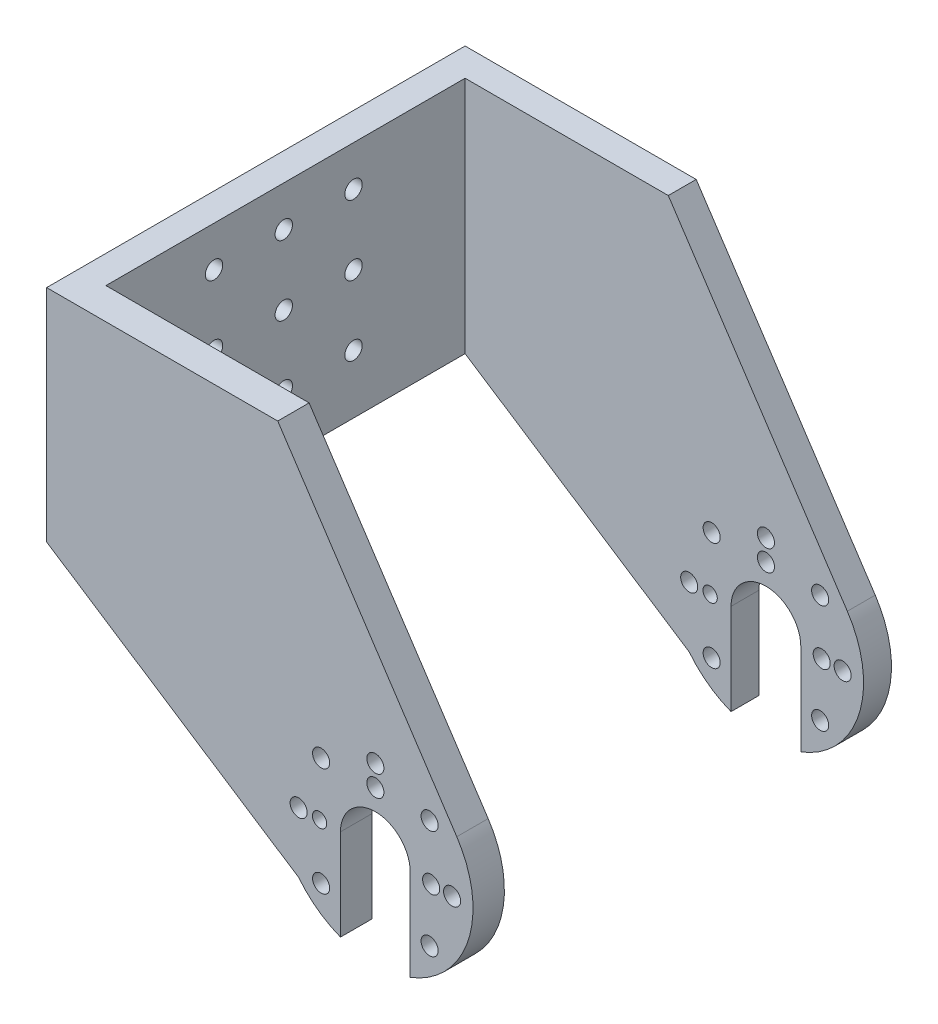
from build123d import *

# Parameters (mm, degrees)
SKETCH_1_R          = 5
SKETCH_1_R_2        = 1.225
SKETCH_1_R_3        = 1.025
EXTRUDE_1_DEPTH     = 60
SKETCH_2_W          = 57.132931415
SKETCH_2_H          = 51.5
CUT_EXTRUDE_1_DEPTH = 66
CUT_EXTRUDE_START   = -60.33903683
CUT_EXTRUDE_3_DEPTH = 60.33903683
SKETCH_6_R          = 1.25
CUT_EXTRUDE_4_DEPTH = 10


with BuildPart() as part:
    # 스케치1 → 보스-돌출1 (new body)
    with BuildSketch(Plane.XY):
        with BuildLine():
            Line((11.674013781, 7.727703555), (-14, 46.512678751))
            Line((-14, 46.512678751), (-47.132931415, 46.512678751))
            Line((-47.132931415, 46.512678751), (-47.132931415, 14.921692086))
            Line((-47.132931415, 14.921692086), (-11, -8.660254038))
            ThreePointArc((-11, -8.660254038), (8.200906179, -11.346591463), (11.674013781, 7.727703555))
        make_face()
        Circle(SKETCH_1_R, mode=Mode.SUBTRACT)
        with Locations((0, 8)):
            Circle(SKETCH_1_R_2, mode=Mode.SUBTRACT)
        with Locations((0, 11)):
            Circle(SKETCH_1_R_2, mode=Mode.SUBTRACT)
        with Locations((7.778174593, 7.778174593)):
            Circle(SKETCH_1_R_2, mode=Mode.SUBTRACT)
        with Locations((8, 0)):
            Circle(SKETCH_1_R_2, mode=Mode.SUBTRACT)
        with Locations((11, 0)):
            Circle(SKETCH_1_R_2, mode=Mode.SUBTRACT)
        with Locations((7.778174593, -7.778174593)):
            Circle(SKETCH_1_R_2, mode=Mode.SUBTRACT)
        with Locations((0, -8)):
            Circle(SKETCH_1_R_2, mode=Mode.SUBTRACT)
        with Locations((0, -11)):
            Circle(SKETCH_1_R_2, mode=Mode.SUBTRACT)
        with Locations((-7.778174593, -7.778174593)):
            Circle(SKETCH_1_R_2, mode=Mode.SUBTRACT)
        with Locations((-8, 0)):
            Circle(SKETCH_1_R_3, mode=Mode.SUBTRACT)
        with Locations((-11, 0)):
            Circle(SKETCH_1_R_2, mode=Mode.SUBTRACT)
        with Locations((-7.778174593, 7.778174593)):
            Circle(SKETCH_1_R_2, mode=Mode.SUBTRACT)
    extrude(amount=EXTRUDE_1_DEPTH)

    # 스케치2 → 컷-돌출1 (cut)
    with BuildSketch(Plane(origin=(0, 46.512678751, 0), x_dir=(1, 0, 0), z_dir=(0, 1, 0))):
        with Locations((-14.566465708, -29.75)):
            Rectangle(SKETCH_2_W, SKETCH_2_H)
    extrude(amount=-CUT_EXTRUDE_1_DEPTH, mode=Mode.SUBTRACT)

    # 스케치4 → 컷-돌출3 (cut)
    with BuildSketch(Plane.XY.offset(60).offset(CUT_EXTRUDE_START)):
        with BuildLine():
            Line((-5, 0), (-5, -13.076696831))
            ThreePointArc((-5, -13.076696831), (0, -14), (5, -13.076696831))
            Line((5, -13.076696831), (5, 0))
            Line((5, 0), (-5, 0))
        make_face()
    extrude(amount=CUT_EXTRUDE_3_DEPTH, mode=Mode.SUBTRACT)

    # 스케치6 → 컷-돌출4 (cut)
    with BuildSketch(Plane.ZY.offset(47.132931415)):
        with Locations(Location((30, 30.717185419, 0), (0, 0, 270))):
            Circle(SKETCH_6_R)
        with Locations(Location((40, 30.717185419, 0), (0, 0, 270))):
            Circle(SKETCH_6_R)
        with Locations(Location((20, 30.717185419, 0), (0, 0, 270))):
            Circle(SKETCH_6_R)
        with Locations(Location((20, 40.717185419, 0), (0, 0, 270))):
            Circle(SKETCH_6_R)
        with Locations(Location((30, 40.717185419, 0), (0, 0, 270))):
            Circle(SKETCH_6_R)
        with Locations(Location((40, 40.717185419, 0), (0, 0, 270))):
            Circle(SKETCH_6_R)
        with Locations(Location((20, 20.717185419, 0), (0, 0, 270))):
            Circle(SKETCH_6_R)
        with Locations(Location((30, 20.717185419, 0), (0, 0, 270))):
            Circle(SKETCH_6_R)
        with Locations(Location((40, 20.717185419, 0), (0, 0, 270))):
            Circle(SKETCH_6_R)
    extrude(amount=-CUT_EXTRUDE_4_DEPTH, mode=Mode.SUBTRACT)


solid = part.part
